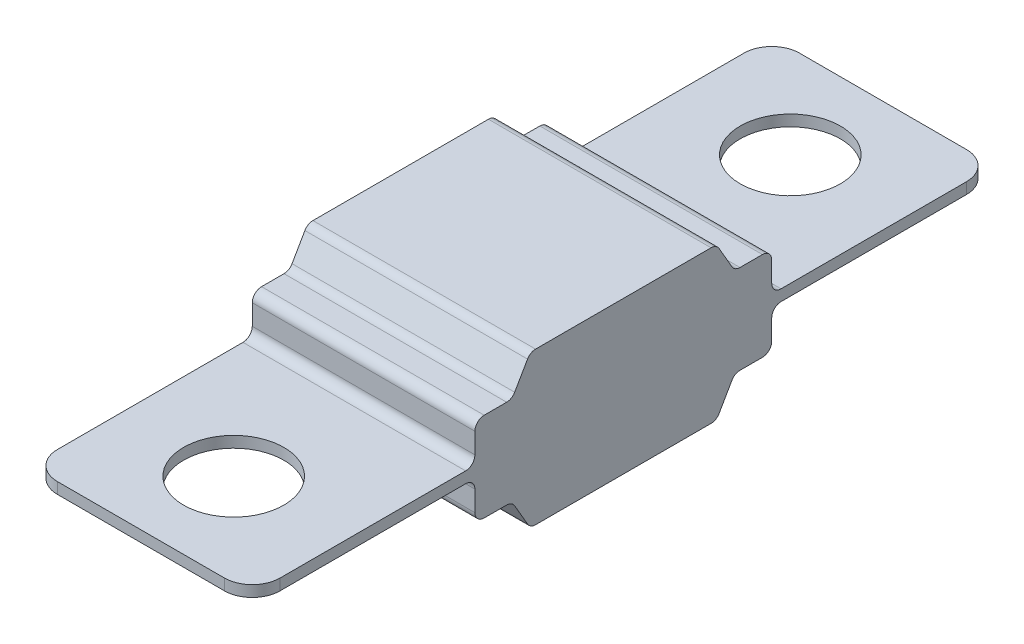
from build123d import *

# Parameters (mm, degrees)
IZIM1_W                     = 40
IZIM1_H                     = 0.6
Y_KSEKLIK_EKSTR_ZYON1_DEPTH = 12
IZIM2_R                     = 2.7
KES_EKSTR_ZYON1_DEPTH       = 42.992380261
RADYUS1_R                   = 1.5
RADYUS2_R                   = 0.5


with BuildPart() as part:
    # Çizim1 → Yükseklik-Ekstrüzyon1 (new body)
    with BuildSketch(Plane(origin=(0, 0, 0), x_dir=(0, 0, -1), z_dir=(1, 0, 0))):
        Polygon((28, 0), (12, 0), (12, -2.1), (14, -2.1), (14.981495458, -3.8), (25.018504542, -3.8), (26, -2.1), (28, -2.1), align=None)
        Polygon((12, 2.7), (12, 0.6), (28, 0.6), (28, 2.7), (26, 2.7), (25.018504542, 4.4), (14.981495458, 4.4), (14, 2.7), align=None)
        with Locations((20, 0.3)):
            Rectangle(IZIM1_W, IZIM1_H)
    extrude(amount=Y_KSEKLIK_EKSTR_ZYON1_DEPTH)

    # Çizim2 → Kes-Ekstrüzyon1 (cut, through all)
    with BuildSketch(Plane(origin=(0, 0.6, 0), x_dir=(1, 0, 0), z_dir=(0, 1, 0))):
        with Locations(Location((6, 5, 0), (0, 0, 270))):
            Circle(IZIM2_R)
        with Locations(Location((6, 35, 0), (0, 0, 270))):
            Circle(IZIM2_R)
    extrude(amount=-KES_EKSTR_ZYON1_DEPTH, mode=Mode.SUBTRACT)

    # Radyus1
    radyus1_edges = [part.edges().sort_by_distance(p)[0] for p in [
        (12, 0.3, -40),
        (0, 0.3, 0),
        (0, 0.3, -40),
        (12, 0.3, 0),
    ]]
    fillet(radyus1_edges, radius=RADYUS1_R)

    # Radyus2
    radyus2_edges = [part.edges().sort_by_distance(p)[0] for p in [
        (6, -2.1, -28),
        (6, -2.1, -26),
        (6, -3.8, -25.018504542),
        (6, -3.8, -14.981495458),
        (6, -2.1, -14),
        (6, -2.1, -12),
        (6, 0, -12),
        (6, 0.6, -12),
        (6, 2.7, -12),
        (6, 2.7, -14),
        (6, 4.4, -14.981495458),
        (6, 4.4, -25.018504542),
        (6, 2.7, -26),
        (6, 2.7, -28),
        (6, 0.6, -28),
        (6, 0, -28),
    ]]
    fillet(radyus2_edges, radius=RADYUS2_R)


solid = part.part
